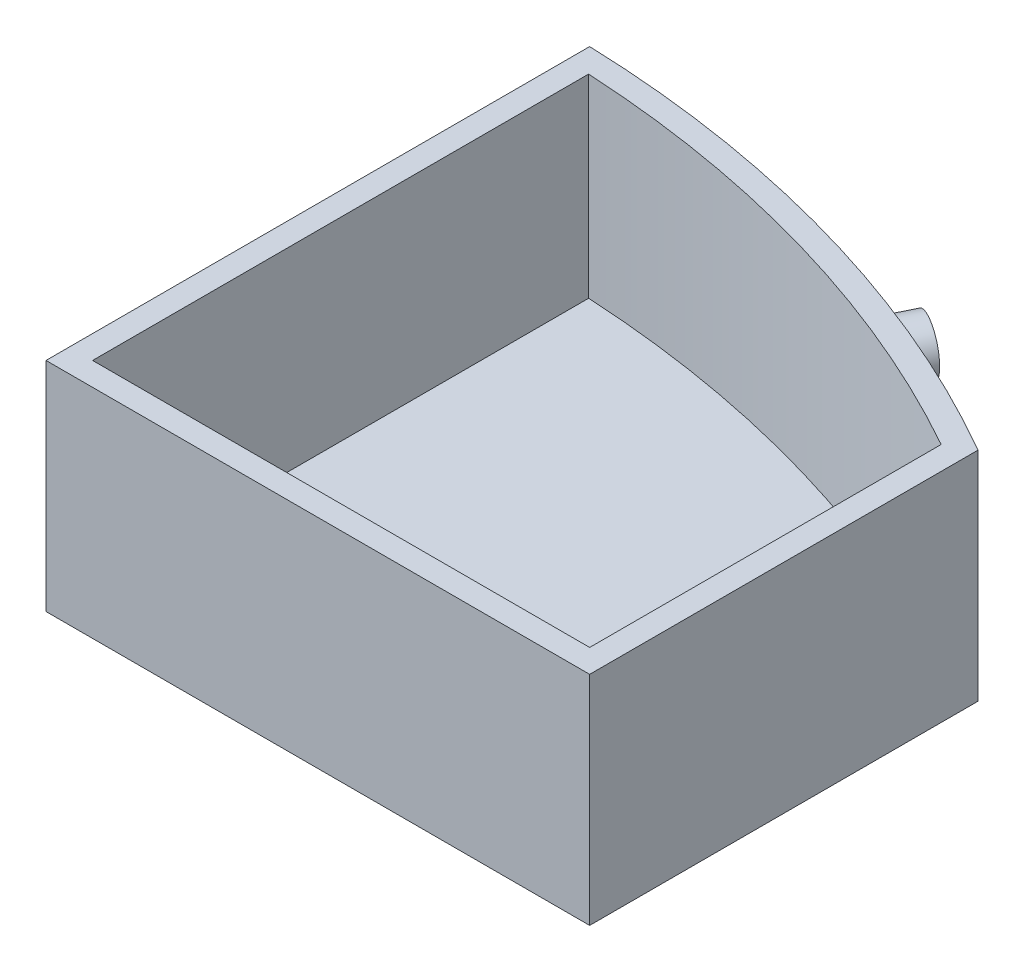
from build123d import *

# Parameters (mm, degrees)
BOSS_EXTRUDE2_DEPTH             = 3
BOSS_EXTRUDE3_DEPTH             = 25
SKETCH11_R                      = 3.5
BOSS_EXTRUDE5_DEPTH             = 7
BOSS_EXTRUDE5_DIRECTION_2_REACH = 85.256


with BuildPart() as part:
    # Sketch1 → Boss-Extrude2 (new body)
    with BuildSketch(Plane(origin=(0, 0, 0), x_dir=(1, 0, 0), z_dir=(0, 1, 0))):
        with BuildLine():
            Line((0, 0), (0, -70))
            Line((0, -70), (70, -70))
            Line((70, -70), (70, -20))
            ThreePointArc((70, -20), (36.231761047, -5.688836334), (0, 0))
        make_face()
    extrude(amount=BOSS_EXTRUDE2_DEPTH)

    # Sketch3 → Boss-Extrude3 (add)
    with BuildSketch(Plane(origin=(0, 3, 0), x_dir=(1, 0, 0), z_dir=(0, 1, 0))):
        with BuildLine():
            Line((70, -70), (70, -20))
            ThreePointArc((70, -20), (36.231761047, -5.688836334), (0, 0))
            Line((0, 0), (0, -70))
            Line((0, -70), (70, -70))
        make_face()
        with BuildLine():
            Line((3, -3.133993062), (3, -67))
            Line((3, -67), (67, -67))
            Line((67, -67), (67, -21.744121307))
            ThreePointArc((67, -21.744121307), (36.068657655, -8.763956776), (3, -3.133993062))
        make_face(mode=Mode.SUBTRACT)
    extrude(amount=BOSS_EXTRUDE3_DEPTH)

    # Sketch11 → Boss-Extrude5 (add)
    with BuildSketch(Plane(origin=(61.178699811, 14, 15.293872991), x_dir=(-0.8974903699241337, 0, -0.4410340529862085), z_dir=(0.4410340529862085, 0, -0.8974903699241337))):
        with Locations((25.829909239, 0)):
            Circle(SKETCH11_R)
    extrude(amount=BOSS_EXTRUDE5_DEPTH)

    # Sketch11 → Boss-Extrude5 direction 2 (add, up to next)
    with BuildSketch(Plane(origin=(61.178699811, 14, 15.293872991), x_dir=(-0.8974903699241337, 0, -0.4410340529862085), z_dir=(0.4410340529862085, 0, -0.8974903699241337)), mode=Mode.PRIVATE) as boss_extrude5_direction_2_sk1:
        with Locations((25.829909239, 0)):
            Circle(SKETCH11_R)
    boss_extrude5_direction_2_tool1 = extrude(boss_extrude5_direction_2_sk1.sketch, amount=-BOSS_EXTRUDE5_DIRECTION_2_REACH, mode=Mode.PRIVATE) - part.part
    add(boss_extrude5_direction_2_tool1.solids().sort_by_distance((37.996605, 14, 3.902003))[0])


solid = part.part
